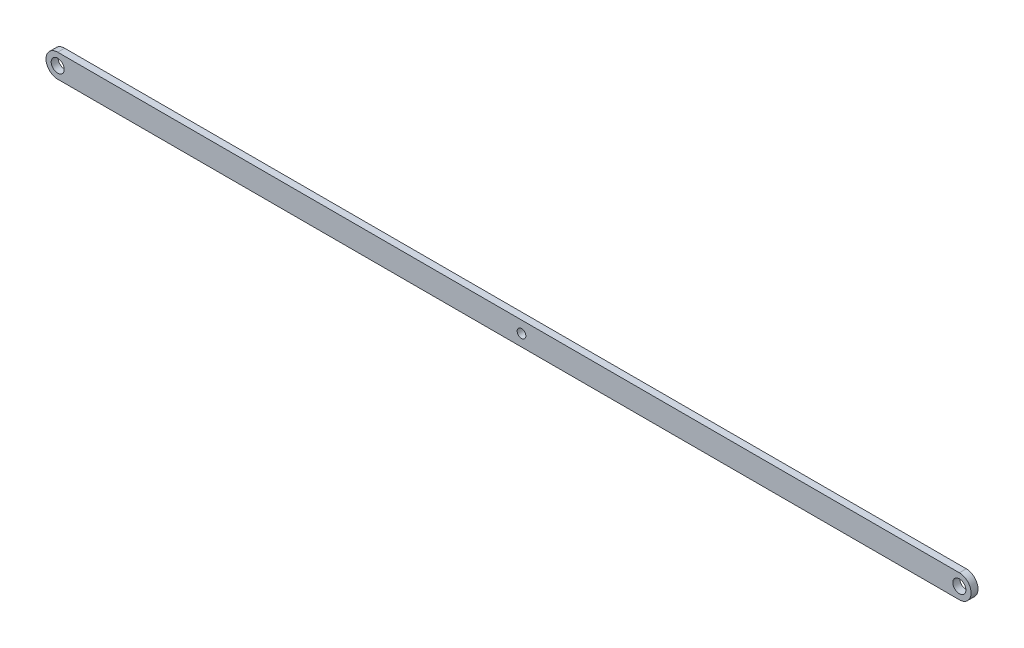
from build123d import *

# Parameters (mm, degrees)
SKETCH1_R           = 46.875
SKETCH1_R_2         = 31.25
BOSS_EXTRUDE1_DEPTH = 50


with BuildPart() as part:
    # Sketch1 → Boss-Extrude1 (new body)
    with BuildSketch(Plane.XY):
        with BuildLine():
            Line((-3250, 84.375), (3250, 84.375))
            ThreePointArc((3250, 84.375), (3334.375, 0), (3250, -84.375))
            Line((3250, -84.375), (-3250, -84.375))
            ThreePointArc((-3250, -84.375), (-3334.375, 0), (-3250, 84.375))
        make_face()
        with Locations((-3250, 0)):
            Circle(SKETCH1_R, mode=Mode.SUBTRACT)
        with Locations((93.418627244, 0)):
            Circle(SKETCH1_R_2, mode=Mode.SUBTRACT)
        with Locations((3250, 0)):
            Circle(SKETCH1_R, mode=Mode.SUBTRACT)
    extrude(amount=BOSS_EXTRUDE1_DEPTH)


solid = part.part
